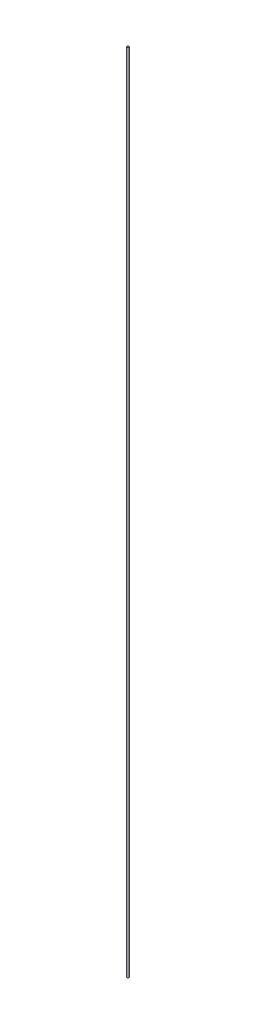
from build123d import *

# Parameters (mm, degrees)
SKETCH1_R           = 5.59
SKETCH1_R_2         = 4.88
BOSS_EXTRUDE1_DEPTH = 2089.35


with BuildPart() as part:
    # Sketch1 → Boss-Extrude1 (new, symmetric)
    with BuildSketch(Plane(origin=(0, 0, 0), x_dir=(1, 0, 0), z_dir=(0, 1, 0))):
        with Locations(Location((0, 0, 0), (0, 0, 270))):
            Circle(SKETCH1_R)
        with Locations(Location((0, 0, 0), (0, 0, 270))):
            Circle(SKETCH1_R_2, mode=Mode.SUBTRACT)
    extrude(amount=BOSS_EXTRUDE1_DEPTH, both=True)


solid = part.part
